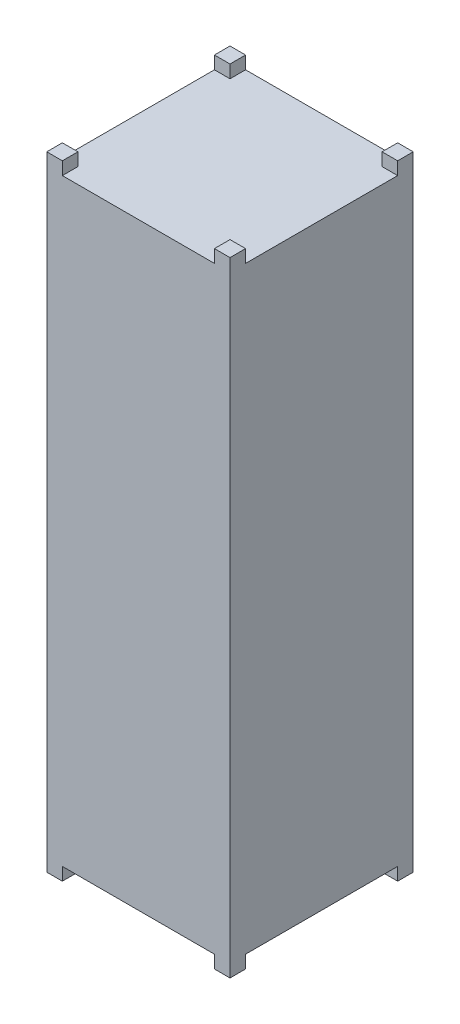
from build123d import *

# Parameters (mm, degrees)
BODY_START  = 7
BODY_DEPTH  = 326.5
CUBESAT_3_W = 8.5
CUBESAT_3_H = 8.5
RAIL_DEPTH  = 340.5


with BuildPart() as part:
    # CubeSat → BODY (new body)
    with BuildSketch(Plane(origin=(0, 0, 0), x_dir=(1, 0, 0), z_dir=(0, 1, 0)).offset(BODY_START)):
        Polygon((-41.5, -41.5), (-41.5, -50), (41.5, -50), (41.5, -41.5), (50, -41.5), (50, 41.5), (41.5, 41.5), (41.5, 50), (-40.728521389, 50), (-41.5, 50), (-41.5, 41.5), (-50, 41.5), (-50, 40.728521389), (-50, -41.5), align=None)
    extrude(amount=BODY_DEPTH)

    # CubeSat<3> → Rail (add)
    with BuildSketch(Plane(origin=(0, 0, 0), x_dir=(1, 0, 0), z_dir=(0, 1, 0))):
        with Locations((-45.75, -45.75)):
            Rectangle(CUBESAT_3_W, CUBESAT_3_H)
        with Locations((45.75, -45.75)):
            Rectangle(CUBESAT_3_W, CUBESAT_3_H)
        with Locations((-45.75, 45.75)):
            Rectangle(CUBESAT_3_W, CUBESAT_3_H)
        with Locations((45.75, 45.75)):
            Rectangle(CUBESAT_3_W, CUBESAT_3_H)
    extrude(amount=RAIL_DEPTH)


solid = part.part
